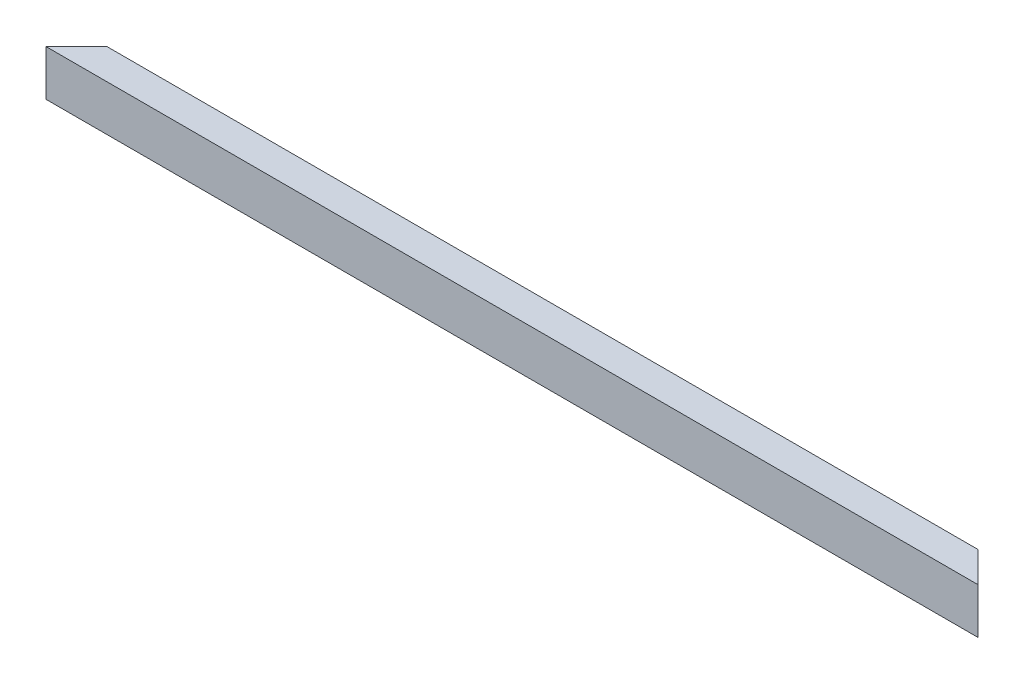
from build123d import *

# Parameters (mm, degrees)
BOSS_EXTRUDE1_DEPTH = 18
SKETCH2_W           = 28.744942217
SKETCH2_H           = 2
SKETCH2_W_2         = 16.222921702
CUT_EXTRUDE1_DEPTH  = 3


with BuildPart() as part:
    # Sketch1 → Boss-Extrude1 (new body)
    with BuildSketch(Plane(origin=(0, 0, 0), x_dir=(1, 0, 0), z_dir=(0, 1, 0))):
        Polygon((171.5, 0), (0, 0), (0, -12), (183.5, -12), align=None)
        Polygon((0, 0), (-171.5, 0), (-183.5, -12), (0, -12), align=None)
    extrude(amount=BOSS_EXTRUDE1_DEPTH)

    # Sketch2 → Cut-Extrude1 (cut)
    with BuildSketch(Plane(origin=(0, 0, 0), x_dir=(-1, 0, 0), z_dir=(0, 0, -1))):
        Polygon((-148.243209669, 15), (-171.5, 15), (-171.5, 13), (-148.243209669, 13), (143.527924007, 13), (171.5, 13), (171.5, 15), (143.527924007, 15), align=None)
        with Locations((185.872471109, 14)):
            Rectangle(SKETCH2_W, SKETCH2_H)
        with Locations((-179.611460851, 14)):
            Rectangle(SKETCH2_W_2, SKETCH2_H)
    extrude(amount=-CUT_EXTRUDE1_DEPTH, mode=Mode.SUBTRACT)


solid = part.part
